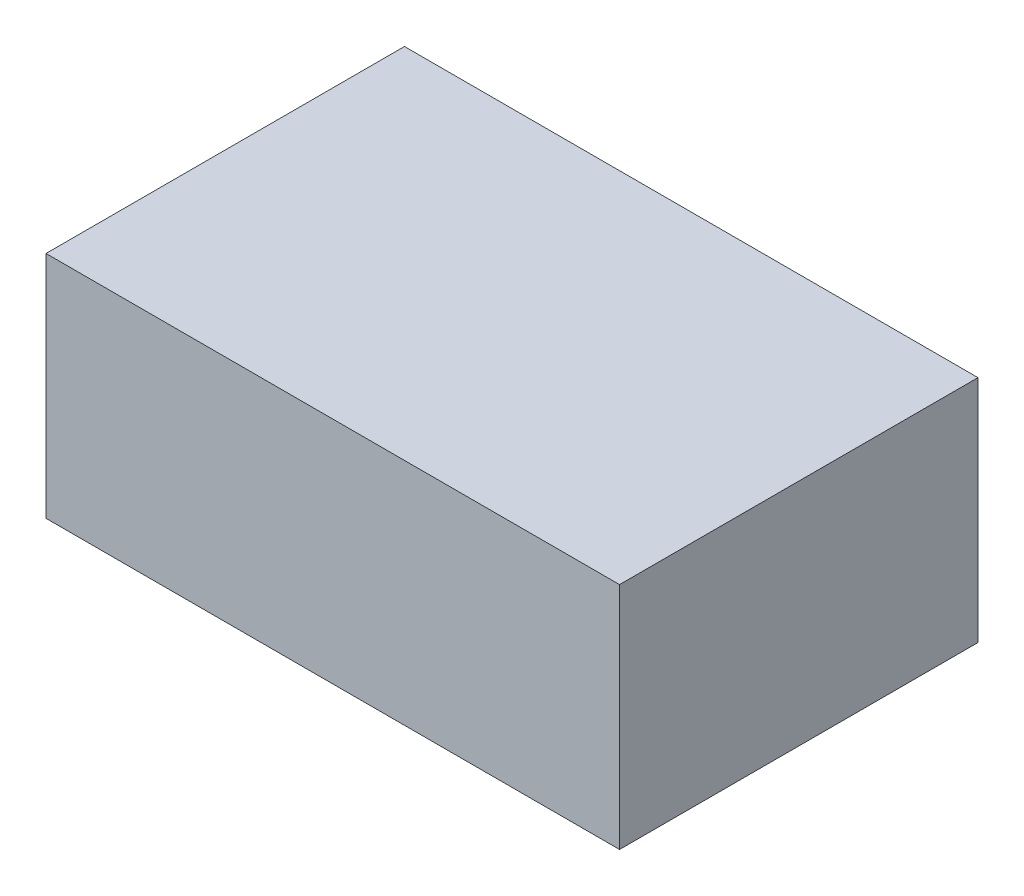
from build123d import *

# Parameters (mm, degrees)
SKETCH1_W           = 40
SKETCH1_H           = 25
BOSS_EXTRUDE1_DEPTH = 16


with BuildPart() as part:
    # Sketch1 → Boss-Extrude1 (new body)
    with BuildSketch(Plane(origin=(0, 0, 0), x_dir=(1, 0, 0), z_dir=(0, 1, 0))):
        with Locations((20, 12.5)):
            Rectangle(SKETCH1_W, SKETCH1_H)
    extrude(amount=BOSS_EXTRUDE1_DEPTH)


solid = part.part
